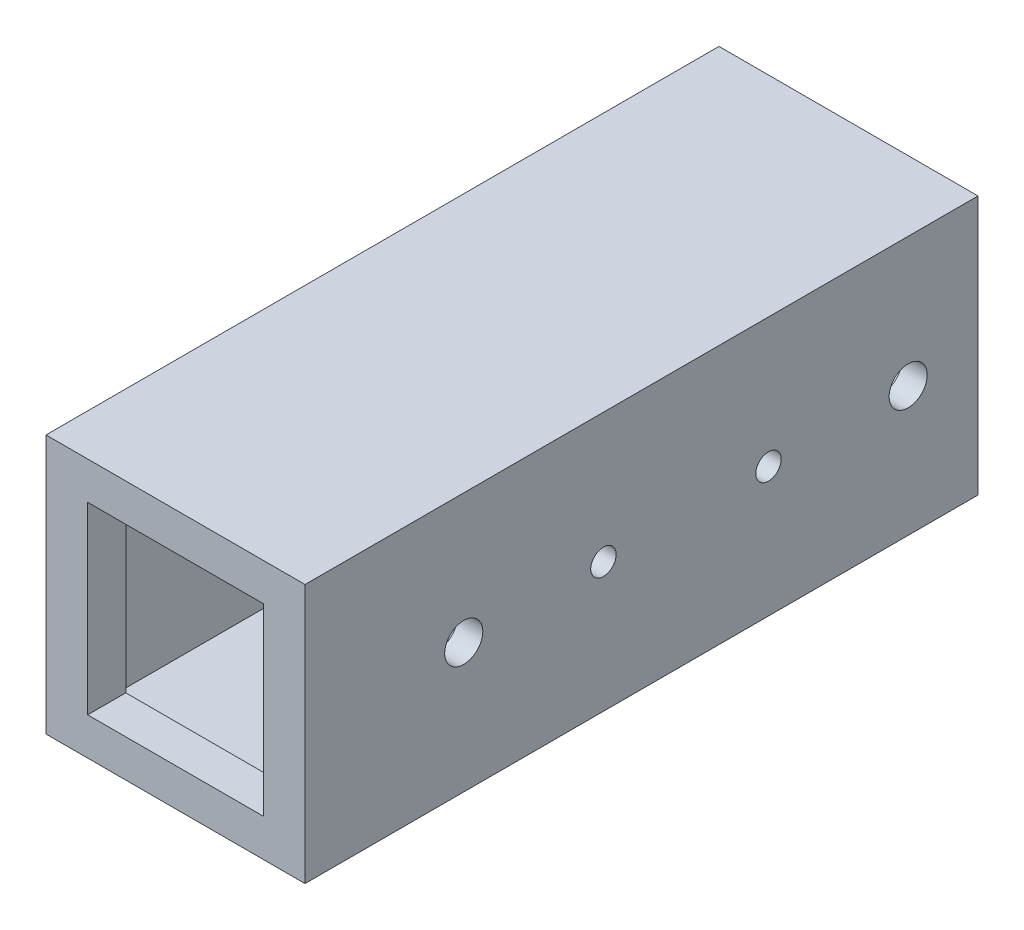
from build123d import *

# Parameters (mm, degrees)
SKETCH1_W           = 20.4
SKETCH1_H           = 20.4
SKETCH1_W_2         = 16.4
SKETCH1_H_2         = 16.4
BOSS_EXTRUDE1_DEPTH = 50
SKETCH2_W           = 20.4
SKETCH2_H           = 20.4
SKETCH2_W_2         = 13.834702386
SKETCH2_H_2         = 14.497254018
BOSS_EXTRUDE2_DEPTH = 3
SKETCH3_R           = 1
SKETCH3_R_2         = 1.5
CUT_EXTRUDE1_DEPTH  = 55.956346312
FILLET1_R           = 1


with BuildPart() as part:
    # Sketch1 → Boss-Extrude1 (new body)
    with BuildSketch(Plane.XY):
        Rectangle(SKETCH1_W, SKETCH1_H)
        Rectangle(SKETCH1_W_2, SKETCH1_H_2, mode=Mode.SUBTRACT)
    extrude(amount=-BOSS_EXTRUDE1_DEPTH)

    # Sketch2 → Boss-Extrude2 (add)
    with BuildSketch(Plane.XY):
        Rectangle(SKETCH2_W, SKETCH2_H)
        Rectangle(SKETCH2_W_2, SKETCH2_H_2, mode=Mode.SUBTRACT)
    extrude(amount=BOSS_EXTRUDE2_DEPTH)

    # Sketch3 → Cut-Extrude1 (cut, through all)
    with BuildSketch(Plane(origin=(10.2, 0, 0), x_dir=(0, 0, -1), z_dir=(1, 0, 0))):
        with Locations((20.5, 0)):
            Circle(SKETCH3_R)
        with Locations((9.5, 0)):
            Circle(SKETCH3_R_2)
        with Locations((33.5, 0)):
            Circle(SKETCH3_R)
        with Locations((44.5, 0)):
            Circle(SKETCH3_R_2)
    extrude(amount=-CUT_EXTRUDE1_DEPTH, mode=Mode.SUBTRACT)

    # Fillet1
    fillet1_edges = [part.edges().sort_by_distance(p)[0] for p in [
        (-8.2, 0, -50),
        (0, -8.2, -50),
        (8.2, 0, -50),
        (0, 8.2, -50),
    ]]
    fillet(fillet1_edges, radius=FILLET1_R)


solid = part.part
